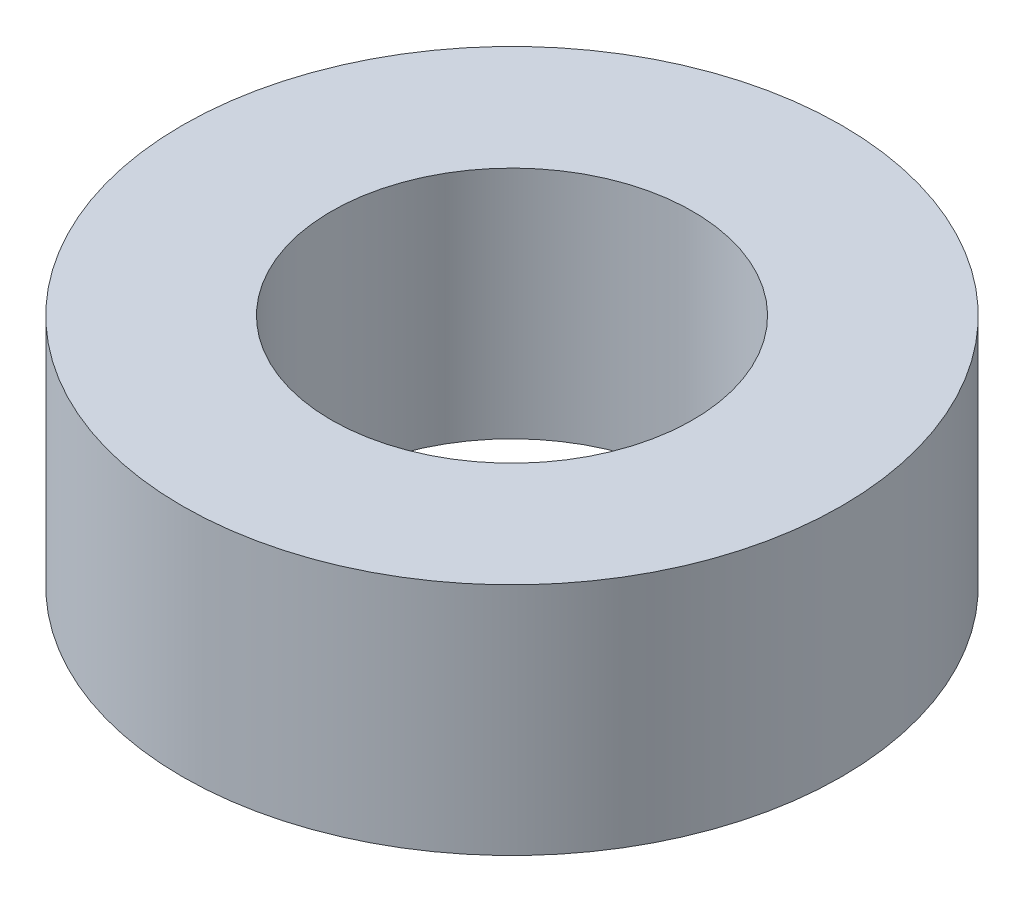
from build123d import *

# Parameters (mm, degrees)
SKETCH1_R           = 6.75
SKETCH1_R_2         = 3.7
BOSS_EXTRUDE1_DEPTH = 4.8


with BuildPart() as part:
    # Sketch1 → Boss-Extrude1 (new body)
    with BuildSketch(Plane(origin=(0, 0, 0), x_dir=(1, 0, 0), z_dir=(0, 1, 0))):
        with Locations(Location((0, 0, 0), (0, 0, 270))):
            Circle(SKETCH1_R)
        with Locations(Location((0, 0, 0), (0, 0, 270))):
            Circle(SKETCH1_R_2, mode=Mode.SUBTRACT)
    extrude(amount=BOSS_EXTRUDE1_DEPTH)


solid = part.part
